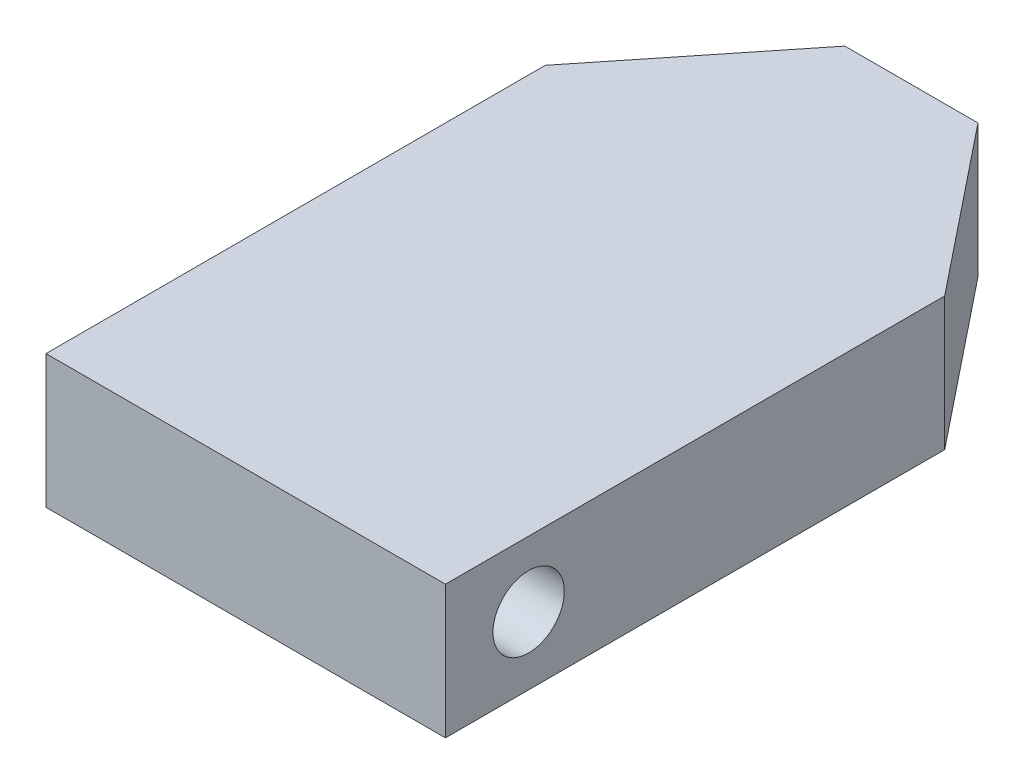
from build123d import *

# Parameters (mm, degrees)
BOSS_EXTRUDE4_DEPTH = 40
SKETCH5_R           = 10.720024077
CUT_EXTRUDE1_DEPTH  = 120


with BuildPart() as part:
    # Sketch1 → Boss-Extrude4 (new body)
    with BuildSketch(Plane(origin=(0, 0, 0), x_dir=(1, 0, 0), z_dir=(0, 1, 0))):
        Polygon((-101.900826446, 53.429752066), (-101.900826446, -96.570247934), (18.099173554, -96.570247934), (18.099173554, 53.429752066), (-21.900826446, 103.429752066), (-41.900826446, 103.429752066), (-61.900826446, 103.429752066), align=None)
    extrude(amount=BOSS_EXTRUDE4_DEPTH)

    # Sketch5 → Cut-Extrude1 (cut)
    with BuildSketch(Plane.ZY.offset(101.900826446)):
        with Locations((71.572647324, 20.323286204)):
            Circle(SKETCH5_R)
    extrude(amount=-CUT_EXTRUDE1_DEPTH, mode=Mode.SUBTRACT)


solid = part.part
